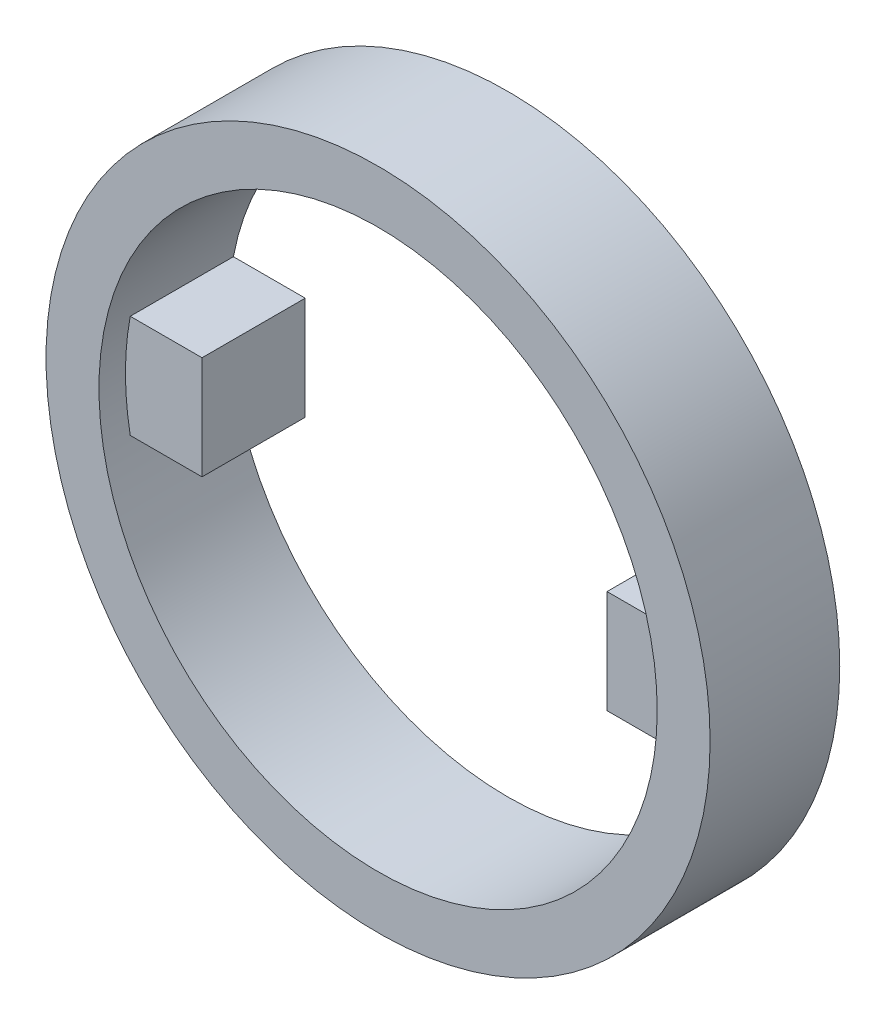
from build123d import *

# Parameters (mm, degrees)
SKETCH_1_R      = 12.55
SKETCH_1_R_2    = 10.55
EXTRUDE_1_DEPTH = 4.9
SKETCH_2_W      = 3.555672838
SKETCH_2_H      = 3.9
EXTRUDE_2_DEPTH = 3.9


with BuildPart() as part:
    # 草图1 → 拉伸-薄壁1 (new body)
    with BuildSketch(Plane.XY):
        Circle(SKETCH_1_R)
        Circle(SKETCH_1_R_2, mode=Mode.SUBTRACT)
    extrude(amount=EXTRUDE_1_DEPTH)

    # 草图2 → 凸台-拉伸2 (add)
    with BuildSketch(Plane.XY):
        with Locations((-9.432034927, 0)):
            Rectangle(SKETCH_2_W, SKETCH_2_H)
        with Locations((9.432034927, 0)):
            Rectangle(SKETCH_2_W, SKETCH_2_H)
    extrude(amount=EXTRUDE_2_DEPTH)


solid = part.part
